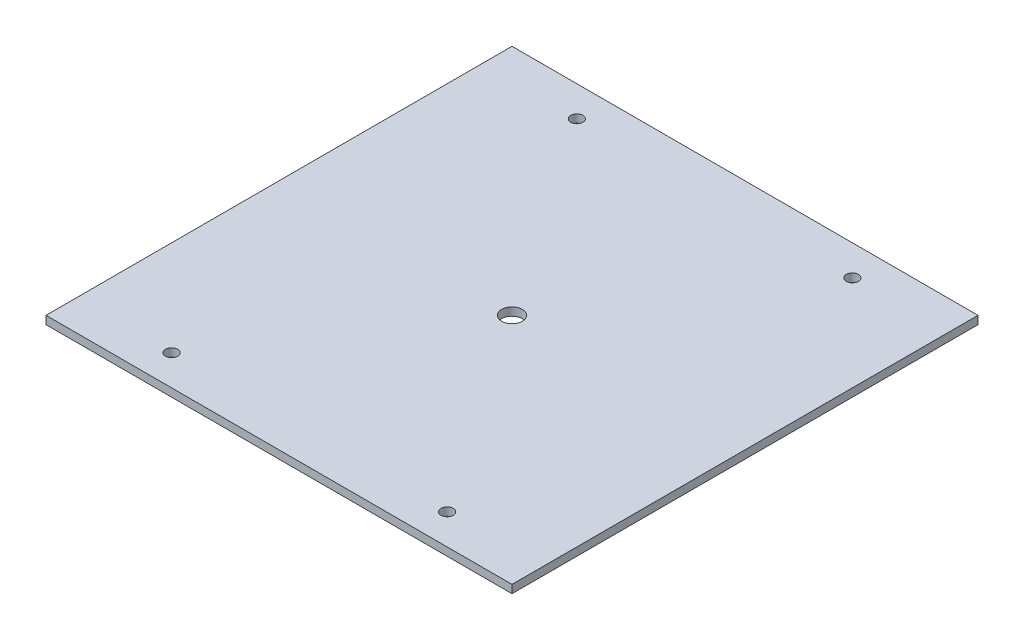
from build123d import *

# Parameters (mm, degrees)
SKETCH1_W             = 115
SKETCH1_H             = 115
SKETCH1_R             = 2.55
BOSS_EXTRUDE1_DEPTH   = 2
F_3_0MM_DOWEL_HOLE1_D = 3


with BuildPart() as part:
    # Sketch1 → Boss-Extrude1 (new body)
    with BuildSketch(Plane(origin=(0, 0, 0), x_dir=(1, 0, 0), z_dir=(0, 1, 0))):
        Rectangle(SKETCH1_W, SKETCH1_H)
        with Locations(Location((0, 0, 0), (0, 0, 270))):
            Circle(SKETCH1_R, mode=Mode.SUBTRACT)
    extrude(amount=BOSS_EXTRUDE1_DEPTH)

    # Ø3.0mm Dowel Hole1 (through all)
    with Locations(Plane(origin=(0, 2, 0), x_dir=(1, 0, 0), z_dir=(0, 1, 0))):
        with Locations((-34, 50), (34, 50), (34, -50), (-34, -50)):
            Hole(F_3_0MM_DOWEL_HOLE1_D / 2)


solid = part.part
